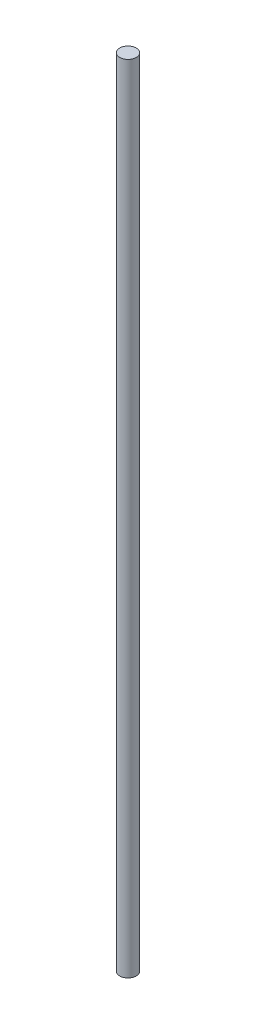
from build123d import *

# Parameters (mm, degrees)
CROQUIS1_R              = 4
SALIENTE_EXTRUIR1_DEPTH = 386.5


with BuildPart() as part:
    # Croquis1 → Saliente-Extruir1 (new body)
    with BuildSketch(Plane(origin=(0, 0, 0), x_dir=(1, 0, 0), z_dir=(0, 1, 0))):
        with Locations(Location((-8.568340902, 5.41821557, 0), (0, 0, 270))):
            Circle(CROQUIS1_R)
    extrude(amount=SALIENTE_EXTRUIR1_DEPTH)


solid = part.part
